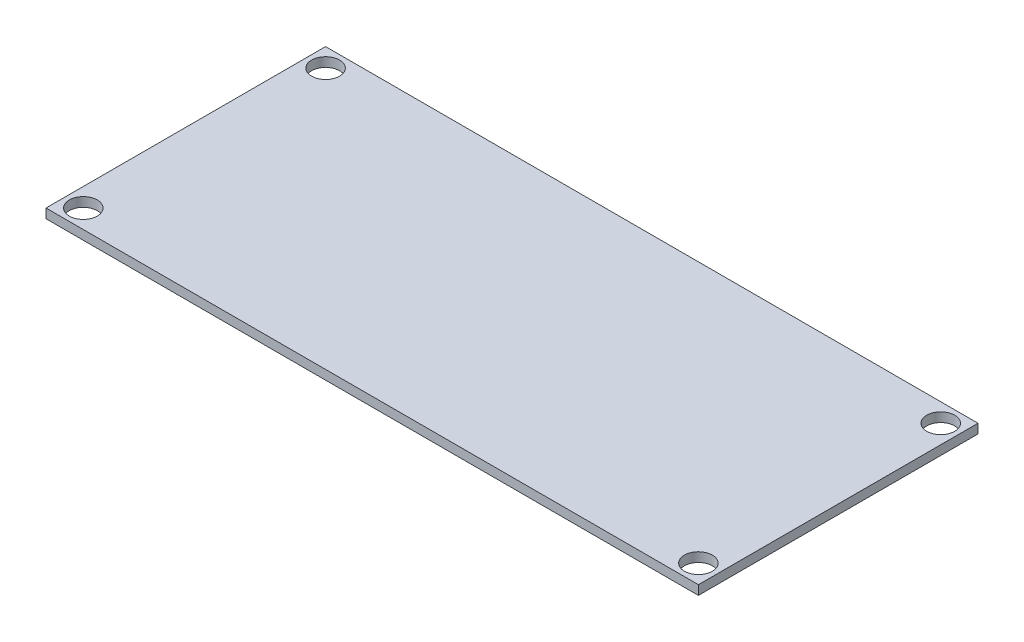
from build123d import *

# Parameters (mm, degrees)
SKETCH1_W           = 70
SKETCH1_H           = 30
SKETCH1_R           = 1.5
BOSS_EXTRUDE1_DEPTH = 1


with BuildPart() as part:
    # Sketch1 → Boss-Extrude1 (new body)
    with BuildSketch(Plane(origin=(0, 0, 0), x_dir=(1, 0, 0), z_dir=(0, 1, 0))):
        Rectangle(SKETCH1_W, SKETCH1_H)
        with Locations(Location((-33, 13, 0), (0, 0, 270))):
            Circle(SKETCH1_R, mode=Mode.SUBTRACT)
        with Locations(Location((33, 13, 0), (0, 0, 270))):
            Circle(SKETCH1_R, mode=Mode.SUBTRACT)
        with Locations(Location((33, -13, 0), (0, 0, 270))):
            Circle(SKETCH1_R, mode=Mode.SUBTRACT)
        with Locations(Location((-33, -13, 0), (0, 0, 270))):
            Circle(SKETCH1_R, mode=Mode.SUBTRACT)
    extrude(amount=BOSS_EXTRUDE1_DEPTH)


solid = part.part
